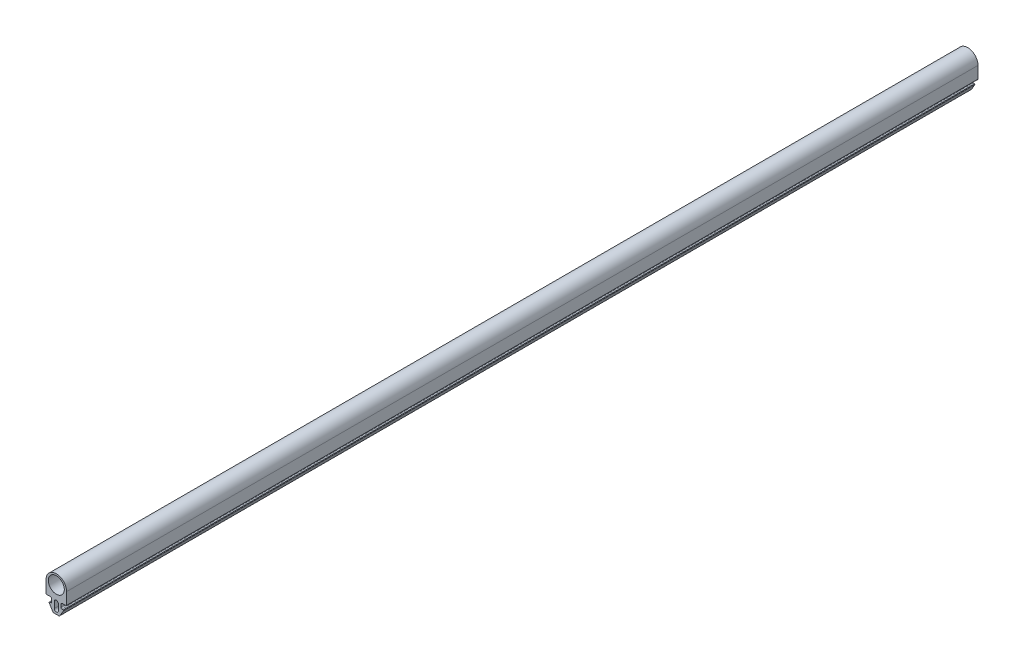
from build123d import *

# Parameters (mm, degrees)
ESQUISSE1_R        = 7
BOSS_EXTRU_1_DEPTH = 796


with BuildPart() as part:
    # Esquisse1 → Boss.-Extru.1 (new body)
    with BuildSketch(Plane.XY.offset(20)):
        with BuildLine():
            Line((-9, 10.864586864), (-9, 0.523924837))
            ThreePointArc((-9, 0.523924837), (-8.854824532, 0.14661401), (-8.478070356, 0))
            Line((-8.478070356, 0), (-5.5, 0))
            ThreePointArc((-5.5, 0), (-4.439339828, -0.439339828), (-4, -1.5))
            Line((-4, -1.5), (-4, -3.5))
            ThreePointArc((-4, -3.5), (-4.292893219, -4.207106781), (-5, -4.5))
            Line((-5, -4.5), (-6.016007613, -4.5))
            ThreePointArc((-6.016007613, -4.5), (-6.227713349, -4.802430523), (-6.174193657, -5.16769643))
            Line((-6.174193657, -5.16769643), (-3.440043573, -9.90338329))
            ThreePointArc((-3.440043573, -9.90338329), (-2.707992766, -10.635434098), (-1.707992766, -10.90338329))
            Line((-1.707992766, -10.90338329), (1.707992766, -10.90338329))
            ThreePointArc((1.707992766, -10.90338329), (2.707992766, -10.635434098), (3.440043573, -9.90338329))
            Line((3.440043573, -9.90338329), (6.174193657, -5.16769643))
            ThreePointArc((6.174193657, -5.16769643), (6.227713349, -4.802430523), (6.016007614, -4.5))
            Line((6.016007614, -4.5), (5, -4.5))
            ThreePointArc((5, -4.5), (4.292893219, -4.207106781), (4, -3.5))
            Line((4, -3.5), (4, -1.5))
            ThreePointArc((4, -1.5), (4.439339828, -0.439339828), (5.5, 0))
            Line((5.5, 0), (8.478070356, 0))
            ThreePointArc((8.478070356, 0), (8.854824532, 0.14661401), (9, 0.523924837))
            Line((9, 0.523924837), (9, 10.864586864))
            ThreePointArc((9, 10.864586864), (0, 19.864586864), (-9, 10.864586864))
        make_face()
        with Locations(Location((0, 11.36, 0), (0, 0, 180))):
            Circle(ESQUISSE1_R, mode=Mode.SUBTRACT)
        with BuildLine():
            Line((1.75, -1.95338329), (1.75, -7.351528839))
            ThreePointArc((1.75, -7.351528839), (0, -9.101528839), (-1.75, -7.351528839))
            Line((-1.75, -7.351528839), (-1.75, -1.95338329))
            ThreePointArc((-1.75, -1.95338329), (0, -0.20338329), (1.75, -1.95338329))
        make_face(mode=Mode.SUBTRACT)
    extrude(amount=-BOSS_EXTRU_1_DEPTH)


solid = part.part
